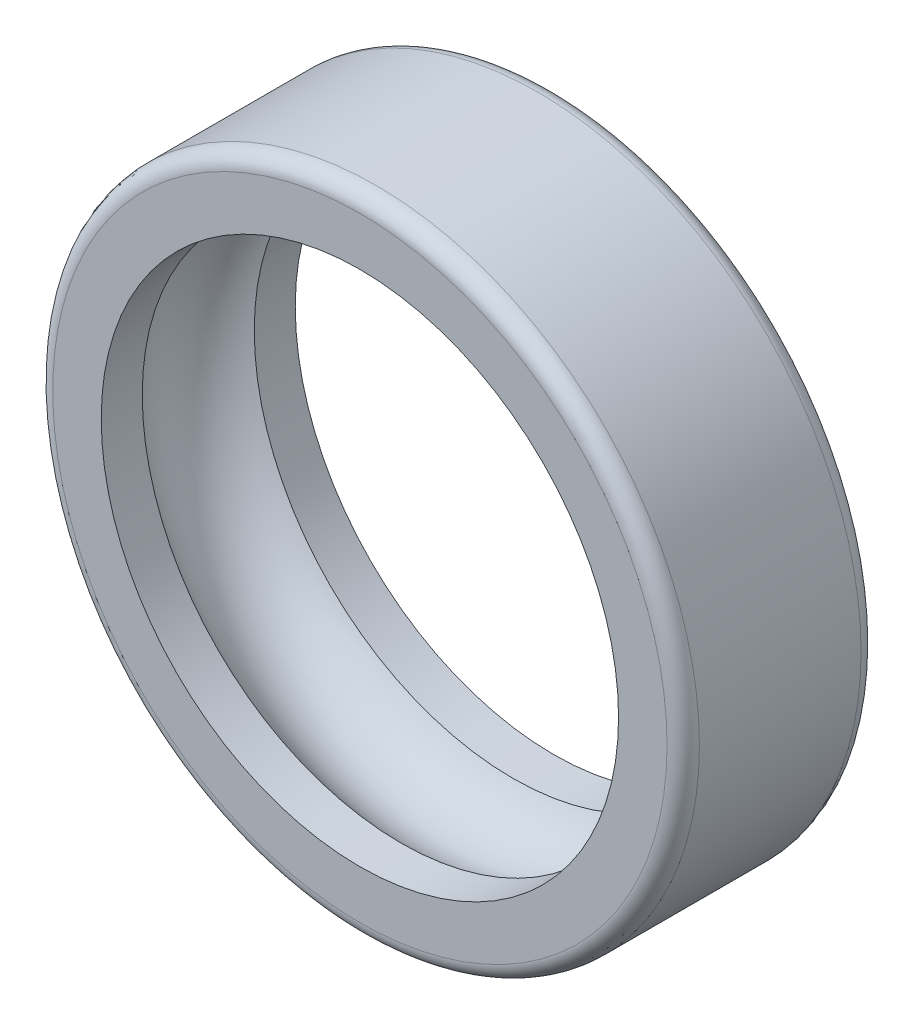
from build123d import *

# Parameters (mm, degrees)
SKETCH1_R           = 10
SKETCH1_R_2         = 8
BOSS_EXTRUDE1_DEPTH = 3
SKETCH2_R           = 2
FILLET1_R           = 0.5


with BuildPart() as part:
    # Sketch1 → Boss-Extrude1 (new, symmetric)
    with BuildSketch(Plane.XY):
        Circle(SKETCH1_R)
        Circle(SKETCH1_R_2, mode=Mode.SUBTRACT)
    extrude(amount=BOSS_EXTRUDE1_DEPTH, both=True)

    # Sketch2 → Cut-Revolve1 (revolve, cut)
    with BuildSketch(Plane(origin=(0, 0, 0), x_dir=(1, 0, 0), z_dir=(0, 1, 0))):
        with Locations((-7, 0)):
            Circle(SKETCH2_R)
    revolve(axis=Axis((0, 0, -1.800319694), (0, 0, 1)), mode=Mode.SUBTRACT)

    # Fillet1
    fillet1_edges = [part.edges().sort_by_distance(p)[0] for p in [
        (-10, 0, -3),
        (-10, 0, 3),
    ]]
    fillet(fillet1_edges, radius=FILLET1_R)


solid = part.part
